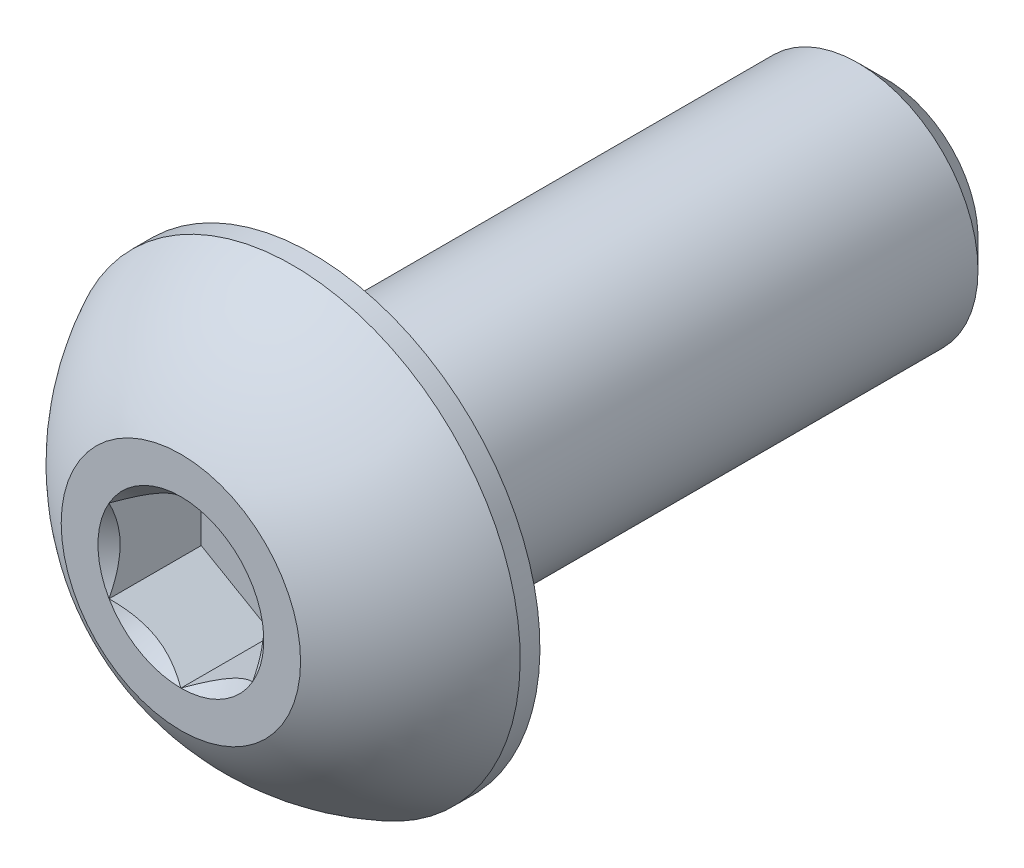
from build123d import *

# Parameters (mm, degrees)
CUT_EXTRUDE2_DEPTH = 1.925


with BuildPart() as part:
    # Sketch10 → Revolve3 (revolve)
    with BuildSketch(Plane(origin=(0, 0, 0), x_dir=(0, 0, -1), z_dir=(1, 0, 0)), mode=Mode.PRIVATE) as revolve3_sk:
        Polygon((5.4, 2.5), (6, 1.9), (6, 0), (-6, 0), (-6, 2.5), align=None)
    revolve(revolve3_sk.sketch.rotate(Axis((0, 0, 8.75), (0, 0, -1)), 180), axis=Axis((0, 0, 8.75), (0, 0, -1)))

    # Sketch7 → Revolve2 (revolve)
    with BuildSketch(Plane(origin=(0, 0, 0), x_dir=(0, 0, -1), z_dir=(1, 0, 0)), mode=Mode.PRIVATE) as revolve2_sk:
        with BuildLine():
            Line((-6.4125, 4.75), (-6, 4.75))
            Line((-6, 4.75), (-6, 0))
            Line((-6, 0), (-8.75, 0))
            Line((-8.75, 0), (-8.75, 2.5))
            ThreePointArc((-8.75, 2.5), (-7.758124817, 3.808753282), (-6.4125, 4.75))
        make_face()
    revolve(revolve2_sk.sketch.rotate(Axis((0, 0, 8.75), (0, 0, -1)), 180), axis=Axis((0, 0, 8.75), (0, 0, -1)))

    # Sketch5 → Cut-Extrude2 (cut)
    with BuildSketch(Plane.XY.offset(8.75)):
        Polygon((1.5, -0.866025404), (1.5, 0.866025404), (0, 1.732050808), (-1.5, 0.866025404), (-1.5, -0.866025404), (0, -1.732050808), align=None)
    extrude(amount=-CUT_EXTRUDE2_DEPTH, mode=Mode.SUBTRACT)

    # Cut-Extrude3 cone 1 section (through the dimple's axis) → Cut-Extrude3 (revolve, cut)
    with BuildSketch(Plane(origin=(0, 0, 8.75), x_dir=(0, -1, 0), z_dir=(1, 0, 0))):
        Polygon((0, 0), (1.732050808, 0), (0, 1.732050808), align=None)
    revolve(axis=Axis((0, 0, 8.75), (0, 0, -1)), mode=Mode.SUBTRACT)


solid = part.part
